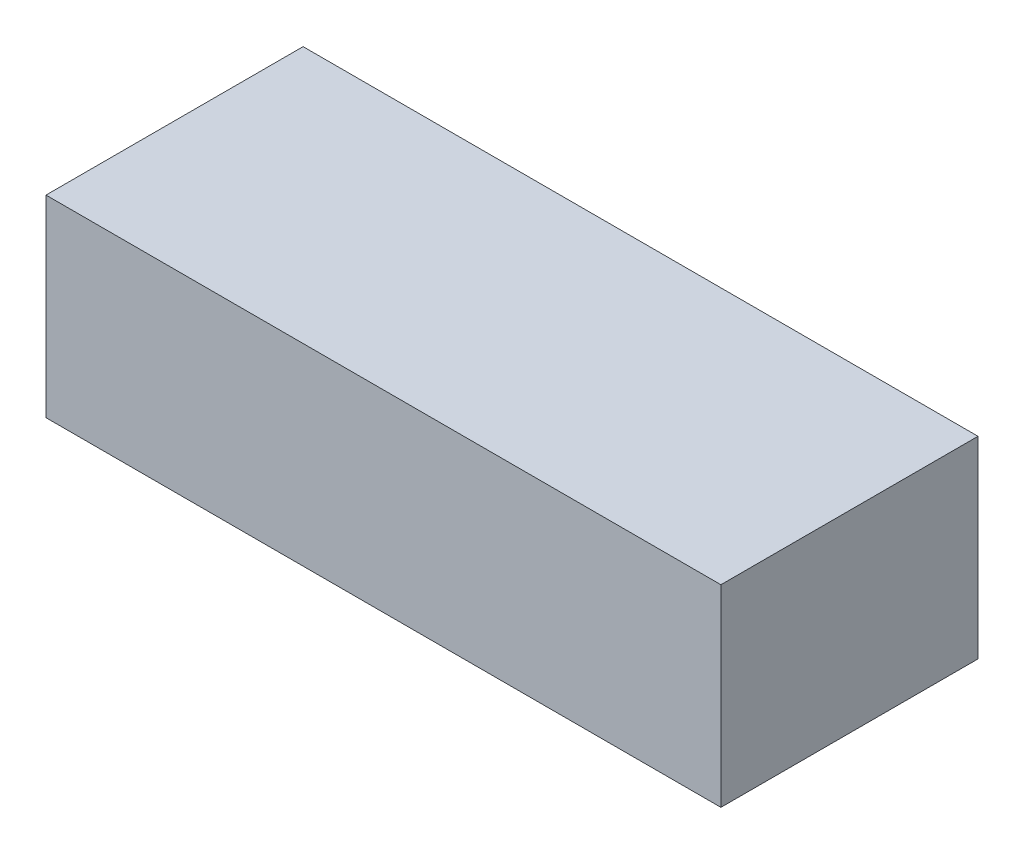
from build123d import *

# Parameters (mm, degrees)
SKETCH1_W           = 21
SKETCH1_H           = 8
BOSS_EXTRUDE1_DEPTH = 6


with BuildPart() as part:
    # Sketch1 → Boss-Extrude1 (new body)
    with BuildSketch(Plane(origin=(0, 0, 0), x_dir=(1, 0, 0), z_dir=(0, 1, 0))):
        with Locations((0.302158273, 0.34352518)):
            Rectangle(SKETCH1_W, SKETCH1_H)
    extrude(amount=BOSS_EXTRUDE1_DEPTH)


solid = part.part
